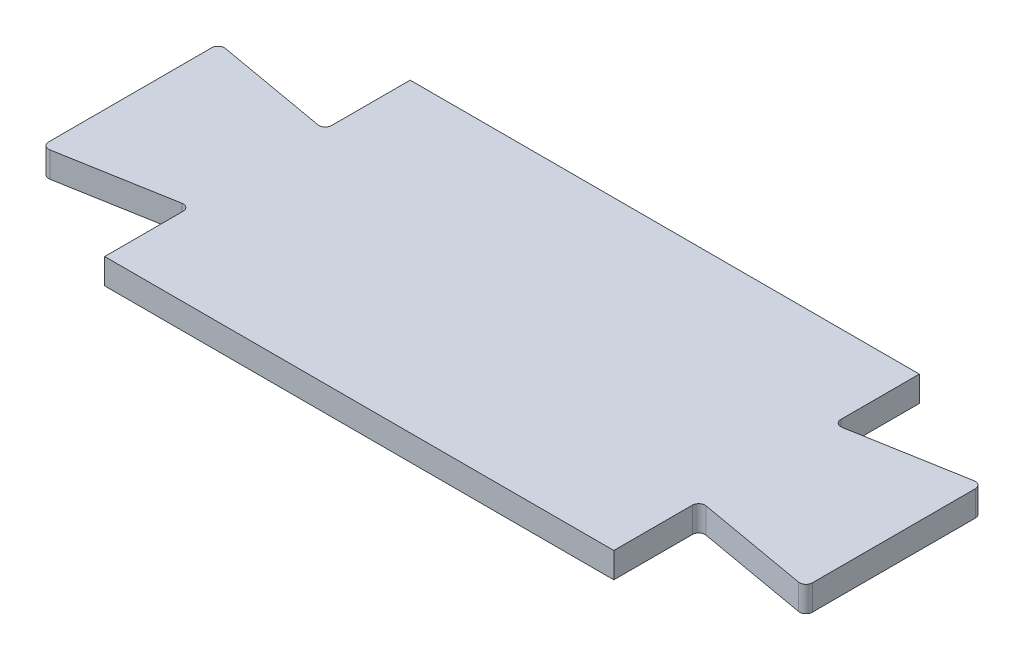
from build123d import *

# Parameters (mm, degrees)
BOSS_EXTRUDE1_DEPTH = 1
FILLET1_R           = 0.25


with BuildPart() as part:
    # Sketch1 → Boss-Extrude1 (new body)
    with BuildSketch(Plane(origin=(0, 0, 0), x_dir=(1, 0, 0), z_dir=(0, 1, 0))):
        Polygon((-10, 2.618365096), (-15, 3.5), (-15, -3.5), (-10, -2.618365096), (-10, -6), (10, -6), (10, -2.618365096), (15, -3.5), (15, 3.5), (10, 2.618365096), (10, 6), (-10, 6), align=None)
    extrude(amount=BOSS_EXTRUDE1_DEPTH)

    # Fillet1
    fillet1_edges = [part.edges().sort_by_distance(p)[0] for p in [
        (10, 0.5, -2.618365096),
        (15, 0.5, -3.5),
        (15, 0.5, 3.5),
        (10, 0.5, 2.618365096),
        (-10, 0.5, 2.618365096),
        (-15, 0.5, 3.5),
        (-15, 0.5, -3.5),
        (-10, 0.5, -2.618365096),
    ]]
    fillet(fillet1_edges, radius=FILLET1_R)


solid = part.part
